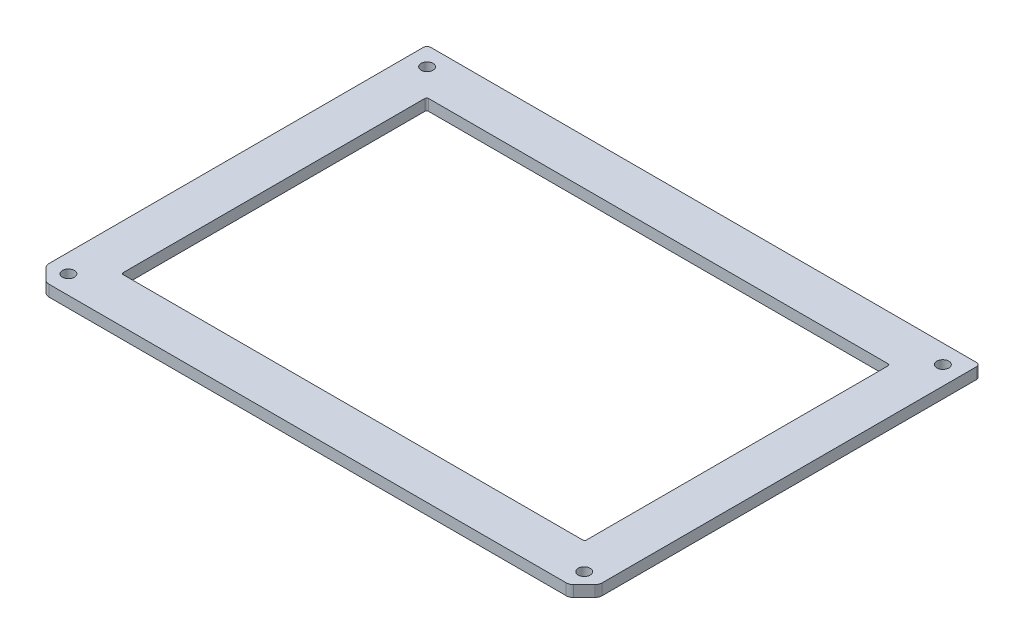
from build123d import *

# Parameters (mm, degrees)
SKETCH1_W           = 148.2
SKETCH1_H           = 106.1
SKETCH1_R           = 1.6
SKETCH1_W_2         = 124.1
SKETCH1_H_2         = 81.8
BOSS_EXTRUDE1_DEPTH = 3
FILLET1_R           = 1
FILLET2_R           = 0.5
CUT_EXTRUDE1_REACH  = 93.182
FILLET3_R           = 2


with BuildPart() as part:
    # Sketch1 → Boss-Extrude1 (new body)
    with BuildSketch(Plane(origin=(0, 0, 0), x_dir=(1, 0, 0), z_dir=(0, 1, 0))):
        Rectangle(SKETCH1_W, SKETCH1_H)
        with Locations(Location((-69.1, 48.05, 0), (0, 0, 270))):
            Circle(SKETCH1_R, mode=Mode.SUBTRACT)
        with Locations(Location((-69.1, -48.05, 0), (0, 0, 90))):
            Circle(SKETCH1_R, mode=Mode.SUBTRACT)
        with Locations(Location((69.1, -48.05, 0), (0, 0, 270))):
            Circle(SKETCH1_R, mode=Mode.SUBTRACT)
        with Locations(Location((69.1, 48.05, 0), (0, 0, 90))):
            Circle(SKETCH1_R, mode=Mode.SUBTRACT)
        Rectangle(SKETCH1_W_2, SKETCH1_H_2, mode=Mode.SUBTRACT)
    extrude(amount=BOSS_EXTRUDE1_DEPTH)

    # Fillet1
    fillet1_edges = [part.edges().sort_by_distance(p)[0] for p in [
        (-74.1, 1.5, -53.05),
        (74.1, 1.5, -53.05),
        (74.1, 1.5, 53.05),
        (-74.1, 1.5, 53.05),
    ]]
    fillet(fillet1_edges, radius=FILLET1_R)

    # Fillet2
    fillet2_edges = [part.edges().sort_by_distance(p)[0] for p in [
        (62.05, 1.5, 40.9),
        (62.05, 1.5, -40.9),
        (-62.05, 1.5, -40.9),
        (-62.05, 1.5, 40.9),
    ]]
    fillet(fillet2_edges, radius=FILLET2_R)

    # Sketch2 → Cut-Extrude1 (cut, up to next)
    with BuildSketch(Plane(origin=(0, 3, 0), x_dir=(-1, 0, 0), z_dir=(0, 1, 0)), mode=Mode.PRIVATE) as cut_extrude1_sk1:
        Polygon((77.1, 46.05), (67.1, 56.05), (77.1, 56.05), align=None)
    cut_extrude1_tool1 = extrude(cut_extrude1_sk1.sketch, amount=-CUT_EXTRUDE1_REACH, mode=Mode.PRIVATE) & part.part
    # Sketch2 → Cut-Extrude1 (cut, up to next)
    with BuildSketch(Plane(origin=(0, 3, 0), x_dir=(-1, 0, 0), z_dir=(0, 1, 0)), mode=Mode.PRIVATE) as cut_extrude1_sk2:
        Polygon((-77.1, 56.05), (-77.1, 46.05), (-67.1, 56.05), align=None)
    cut_extrude1_tool2 = extrude(cut_extrude1_sk2.sketch, amount=-CUT_EXTRUDE1_REACH, mode=Mode.PRIVATE) & part.part
    add(cut_extrude1_tool1.solids().sort_by_distance((-73.766667, 3, 52.716667))[0], mode=Mode.SUBTRACT)
    add(cut_extrude1_tool2.solids().sort_by_distance((73.766667, 3, 52.716667))[0], mode=Mode.SUBTRACT)

    # Fillet3
    fillet3_edges = [part.edges().sort_by_distance(p)[0] for p in [
        (70.1, 1.5, 53.05),
        (74.1, 1.5, 49.05),
        (-74.1, 1.5, 49.05),
        (-70.1, 1.5, 53.05),
    ]]
    fillet(fillet3_edges, radius=FILLET3_R)


solid = part.part
